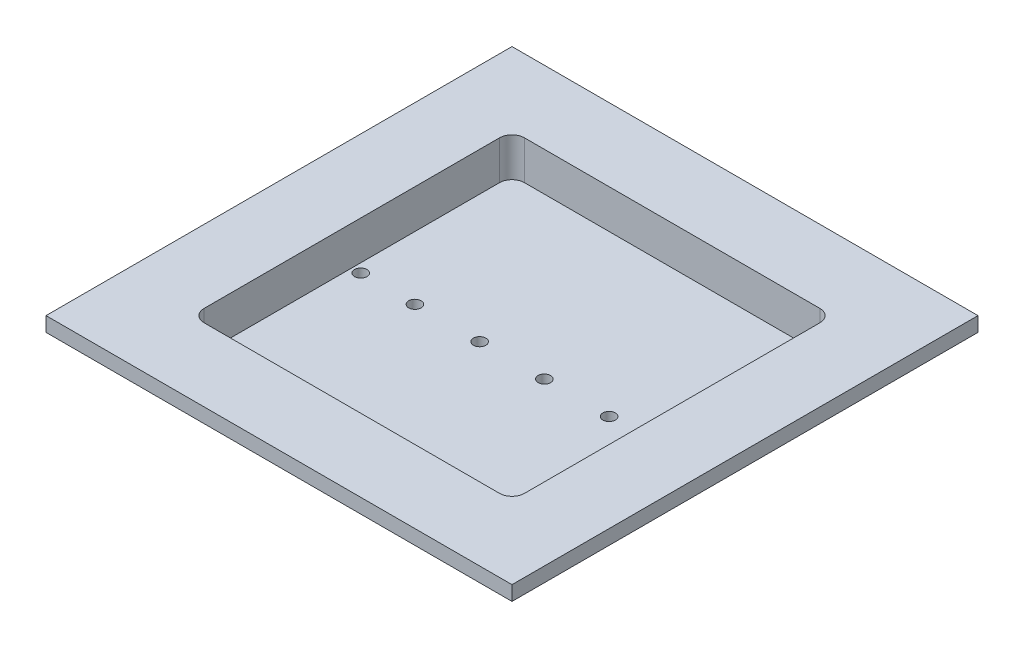
from build123d import *

# Parameters (mm, degrees)
SKETCH1_W           = 74.8
SKETCH1_H           = 74.8
BOSS_EXTRUDE1_DEPTH = 2.3375
SKETCH2_W           = 56.1
SKETCH2_H           = 56.1
BOSS_EXTRUDE2_DEPTH = 7.5
CHAMFER1_SIZE       = 0.25
CUT_EXTRUDE1_DEPTH  = 6.233333333
SKETCH4_R           = 1
CUT_EXTRUDE2_DEPTH  = 4


with BuildPart() as part:
    # Sketch1 → Boss-Extrude1 (new body)
    with BuildSketch(Plane(origin=(0, 0, 0), x_dir=(1, 0, 0), z_dir=(0, 1, 0))):
        with Locations((37.4, 37.4)):
            Rectangle(SKETCH1_W, SKETCH1_H)
    extrude(amount=BOSS_EXTRUDE1_DEPTH)

    # Sketch2 → Boss-Extrude2 (add)
    with BuildSketch(Plane(origin=(0, 0, 0), x_dir=(1, 0, 0), z_dir=(0, 1, 0))):
        with Locations((37.4, 37.4)):
            Rectangle(SKETCH2_W, SKETCH2_H)
    extrude(amount=-BOSS_EXTRUDE2_DEPTH)

    # Chamfer1
    chamfer1_edges = [part.edges().sort_by_distance(p)[0] for p in [
        (9.35, -7.5, -37.4),
        (37.4, -7.5, -65.45),
        (65.45, -7.5, -37.4),
        (37.4, -7.5, -9.35),
        (9.35, 0, -37.4),
        (37.4, 0, -9.35),
        (65.45, 0, -37.4),
        (37.4, 0, -65.45),
    ]]
    chamfer(chamfer1_edges, length=CHAMFER1_SIZE)

    # Sketch3 → Cut-Extrude1 (cut)
    with BuildSketch(Plane(origin=(0, 2.3375, 0), x_dir=(1, 0, 0), z_dir=(0, 1, 0))):
        with BuildLine():
            Line((61.1125, 63.1125), (13.6875, 63.1125))
            ThreePointArc((13.6875, 63.1125), (12.273286438, 62.526713562), (11.6875, 61.1125))
            Line((11.6875, 61.1125), (11.6875, 13.6875))
            ThreePointArc((11.6875, 13.6875), (12.273286438, 12.273286438), (13.6875, 11.6875))
            Line((13.6875, 11.6875), (61.1125, 11.6875))
            ThreePointArc((61.1125, 11.6875), (62.526713562, 12.273286438), (63.1125, 13.6875))
            Line((63.1125, 13.6875), (63.1125, 61.1125))
            ThreePointArc((63.1125, 61.1125), (62.526713562, 62.526713562), (61.1125, 63.1125))
        make_face()
    extrude(amount=-CUT_EXTRUDE1_DEPTH, mode=Mode.SUBTRACT)

    # Sketch4 → Cut-Extrude2 (cut)
    with BuildSketch(Plane(origin=(0, -3.895833333, 0), x_dir=(1, 0, 0), z_dir=(0, 1, 0))):
        with Locations(Location((13.1125, 37.4075, 0), (0, 0, 270))):
            Circle(SKETCH4_R)
        with Locations(Location((21.808611106, 37.4075, 0), (0, 0, 270))):
            Circle(SKETCH4_R)
        with Locations(Location((32.198611106, 37.4075, 0), (0, 0, 270))):
            Circle(SKETCH4_R)
        with Locations(Location((42.588611106, 37.4075, 0), (0, 0, 270))):
            Circle(SKETCH4_R)
        with Locations(Location((52.982499988, 37.4025, 0), (0, 0, 270))):
            Circle(SKETCH4_R)
        with Locations(Location((61.6825, 37.4075, 0), (0, 0, 270))):
            Circle(SKETCH4_R)
    extrude(amount=-CUT_EXTRUDE2_DEPTH, mode=Mode.SUBTRACT)


solid = part.part
